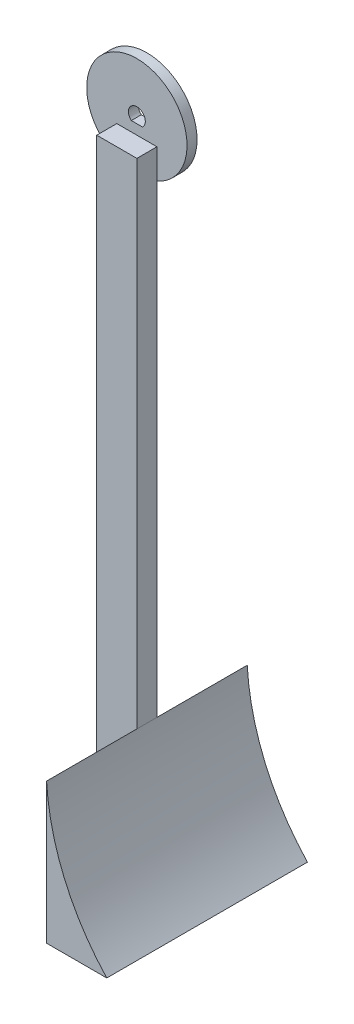
from build123d import *

# Parameters (mm, degrees)
SKETCH2_R               = 12.5
BOSS_EXTRUDE1_DEPTH     = 2.5
BOSS_EXTRUDE2_DEPTH     = 5
SKETCH5_W               = 50
SKETCH5_H               = 35
BOSS_EXTRUDE3_DEPTH     = 15
CUT_EXTRUDE1_DEPTH      = 171.878020085
CUT_EXTRUDE1_DEPTH_BACK = 171.878020085


with BuildPart() as part:
    # Sketch2 → Boss-Extrude1 (new body)
    with BuildSketch(Plane.XY):
        Circle(SKETCH2_R)
        with BuildLine():
            ThreePointArc((1.389019438, -1.575), (0, 2.1), (-1.389019438, -1.575))
            Line((-1.389019438, -1.575), (0, -1.575))
            Line((0, -1.575), (1.389019438, -1.575))
        make_face(mode=Mode.SUBTRACT)
    extrude(amount=BOSS_EXTRUDE1_DEPTH)

    # Sketch4 → Boss-Extrude2 (add)
    with BuildSketch(Plane.XY.offset(2.5)):
        Polygon((-5, -162.170582253), (5, -162.170582253), (5, -4.038316712), (0, -4.038316712), (-5, -4.038316712), align=None)
    extrude(amount=BOSS_EXTRUDE2_DEPTH)

    # Sketch5 → Boss-Extrude3 (add)
    with BuildSketch(Plane(origin=(5, 0, 0), x_dir=(0, 0, -1), z_dir=(1, 0, 0))):
        with Locations((-5, -144.670582253)):
            Rectangle(SKETCH5_W, SKETCH5_H)
    extrude(amount=BOSS_EXTRUDE3_DEPTH)

    # Sketch6 → Cut-Extrude1 (cut, two sides: drawn at the far end of the back side and taken through both)
    with BuildSketch(Plane(origin=(0, 0, -20), x_dir=(-1, 0, 0), z_dir=(0, 0, -1)).offset(-CUT_EXTRUDE1_DEPTH_BACK)):
        with BuildLine():
            Line((-20, -127.170582253), (-5, -127.170582253))
            ThreePointArc((-5, -127.170582253), (-9.438654014, -145.982587676), (-20, -162.170582253))
            Line((-20, -162.170582253), (-20, -127.170582253))
        make_face()
    extrude(amount=CUT_EXTRUDE1_DEPTH + CUT_EXTRUDE1_DEPTH_BACK, mode=Mode.SUBTRACT)


solid = part.part
